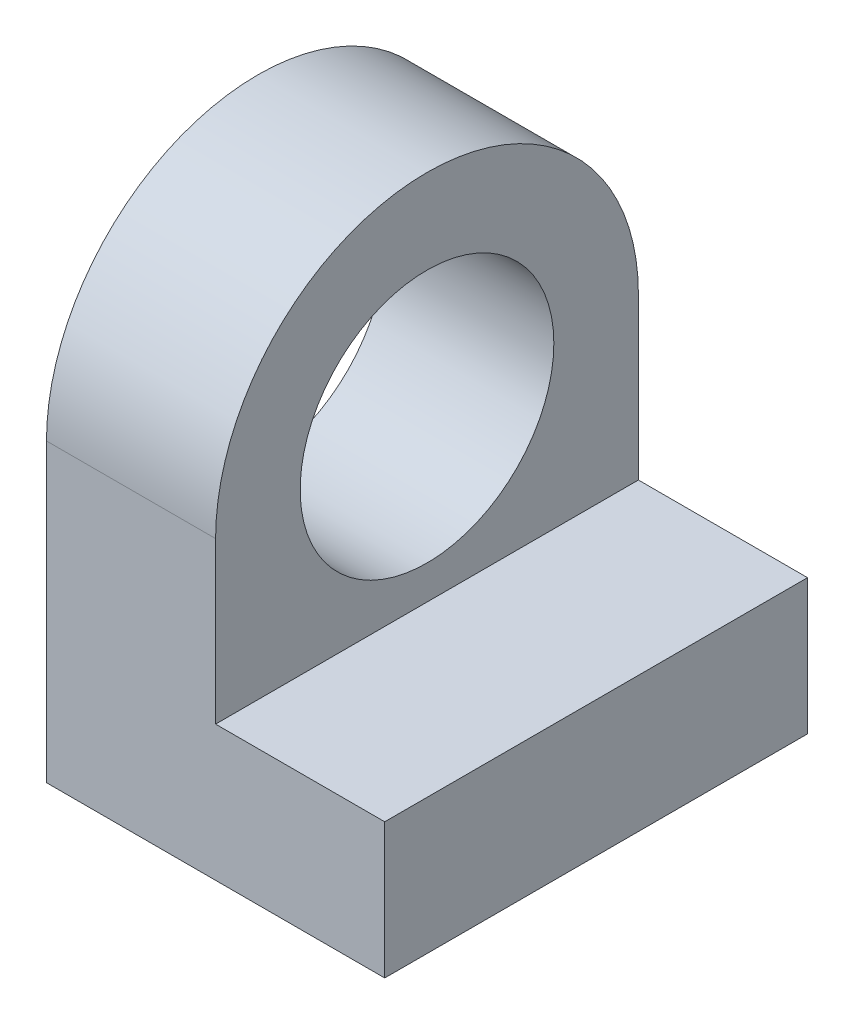
from build123d import *

# Parameters (mm, degrees)
CROQUIS1_R              = 7.5
SALIENTE_EXTRUIR1_DEPTH = 10
CROQUIS2_W              = 25
CROQUIS2_H              = 8
SALIENTE_EXTRUIR2_DEPTH = 10


with BuildPart() as part:
    # Croquis1 → Saliente-Extruir1 (new body)
    with BuildSketch(Plane(origin=(0, 0, 0), x_dir=(0, 0, -1), z_dir=(1, 0, 0))):
        with BuildLine():
            Line((0, 0), (-25, 0))
            Line((-25, 0), (-25, 17.5))
            ThreePointArc((-25, 17.5), (-12.5, 30), (0, 17.5))
            Line((0, 17.5), (0, 0))
        make_face()
        with Locations((-12.5, 17.5)):
            Circle(CROQUIS1_R, mode=Mode.SUBTRACT)
    extrude(amount=SALIENTE_EXTRUIR1_DEPTH)

    # Croquis2 → Saliente-Extruir2 (add)
    with BuildSketch(Plane(origin=(10, 0, 0), x_dir=(0, 0, -1), z_dir=(1, 0, 0))):
        with Locations((-12.5, 4)):
            Rectangle(CROQUIS2_W, CROQUIS2_H)
    extrude(amount=SALIENTE_EXTRUIR2_DEPTH)


solid = part.part
